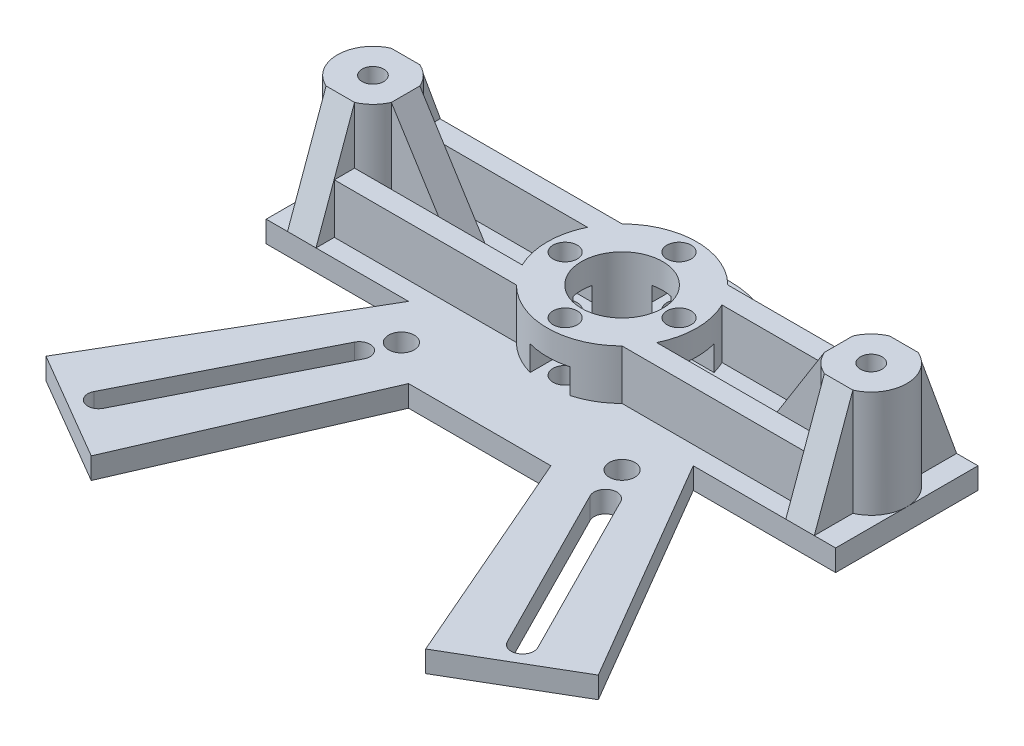
from build123d import *

# Parameters (mm, degrees)
SKETCH_1_R          = 3.2
SKETCH_1_R_2        = 1.8
SKETCH_1_R_3        = 5.7
SKETCH_1_R_4        = 1.7
EXTRUDE_1_DEPTH     = 3
SKETCH_2_R          = 10.5
EXTRUDE_2_DEPTH     = 7
SKETCH_4_R          = 1.7
CUT_EXTRUDE_1_DEPTH = 7
CUT_EXTRUDE_2_DEPTH = 3.5
SKETCH_6_R          = 5.7
CUT_EXTRUDE_3_DEPTH = 20
SKETCH_7_R          = 5
SKETCH_7_R_2        = 1.525
EXTRUDE_3_DEPTH     = 15
SKETCH_8_W          = 10
SKETCH_8_H          = 4
SKETCH_8_W_2        = 4
SKETCH_8_H_2        = 6
EXTRUDE_4_DEPTH     = 15
CUT_EXTRUDE_4_DEPTH = 15
CUT_EXTRUDE_5_DEPTH = 15
CUT_EXTRUDE_6_DEPTH = 15
SKETCH_12_W         = 25.575378798
SKETCH_12_H         = 2.842045507
EXTRUDE_5_DEPTH     = 7


with BuildPart() as part:
    # 草图1 → 凸台-拉伸1 (new body)
    with BuildSketch(Plane(origin=(0, 0, 0), x_dir=(1, 0, 0), z_dir=(0, 1, 0))):
        with BuildLine():
            Line((-35.081832586, -10), (-40, -10))
            Line((-40, -10), (-40, 10))
            Line((-40, 10), (-11.180339887, 10))
            ThreePointArc((-11.180339887, 10), (0, 15), (11.180339887, 10))
            Line((11.180339887, 10), (40, 10))
            Line((40, 10), (40, -10))
            Line((40, -10), (20, -10))
            Line((20, -10), (38.795982487, -42.134997854))
            Line((38.795982487, -42.134997854), (23.493176713, -51.085714784))
            Line((23.493176713, -51.085714784), (10.00055485, -20.000324527))
            Line((10.00055485, -20.000324527), (-9.99944515, -20.000324527))
            Line((-9.99944515, -20.000324527), (-23.493239928, -51.085714784))
            Line((-23.493239928, -51.085714784), (-38.79573581, -42.1354119))
            Line((-38.79573581, -42.1354119), (-20, -10))
            Line((-20, -10), (-35.081832586, -10))
        make_face()
        with Locations(Location((35, 0, 0), (0, 0, 270))):
            Circle(SKETCH_1_R, mode=Mode.SUBTRACT)
        with Locations(Location((-15.5, -15.5, 0), (0, 0, 270))):
            Circle(SKETCH_1_R_2, mode=Mode.SUBTRACT)
        with Locations(Location((15.5, -15.5, 0), (0, 0, 270))):
            Circle(SKETCH_1_R_2, mode=Mode.SUBTRACT)
        with Locations(Location((-35, 0, 0), (0, 0, 270))):
            Circle(SKETCH_1_R, mode=Mode.SUBTRACT)
        with Locations(Location((0, 0, 0), (0, 0, 270))):
            Circle(SKETCH_1_R_3, mode=Mode.SUBTRACT)
        with Locations(Location((-8, 0, 0), (0, 0, 270))):
            Circle(SKETCH_1_R_4, mode=Mode.SUBTRACT)
        with Locations(Location((0, 8, 0), (0, 0, 270))):
            Circle(SKETCH_1_R_4, mode=Mode.SUBTRACT)
        with Locations(Location((8, 0, 0), (0, 0, 270))):
            Circle(SKETCH_1_R_4, mode=Mode.SUBTRACT)
        with Locations(Location((0, -8, 0), (0, 0, 270))):
            Circle(SKETCH_1_R_4, mode=Mode.SUBTRACT)
        with BuildLine():
            Line((-16.131862345, -20.121977189), (-28.419219954, -44.445930008))
            ThreePointArc((-28.419219954, -44.445930008), (-30.461319047, -45.117305053), (-31.132694091, -43.07520596))
            Line((-31.132694091, -43.07520596), (-18.845336482, -18.75125314))
            ThreePointArc((-18.845336482, -18.75125314), (-16.803237389, -18.079878096), (-16.131862345, -20.121977189))
        make_face(mode=Mode.SUBTRACT)
        with BuildLine():
            Line((19.251434516, -19.436615165), (31.203359651, -43.037711333))
            ThreePointArc((31.203359651, -43.037711333), (30.498813674, -45.187970612), (28.348554395, -44.483424635))
            Line((28.348554395, -44.483424635), (16.39662926, -20.882328467))
            ThreePointArc((16.39662926, -20.882328467), (17.101175237, -18.732069188), (19.251434516, -19.436615165))
        make_face(mode=Mode.SUBTRACT)
    extrude(amount=EXTRUDE_1_DEPTH)

    # 草图2 → 凸台-拉伸2 (add)
    with BuildSketch(Plane(origin=(0, 3, 0), x_dir=(1, 0, 0), z_dir=(0, 1, 0))):
        with Locations(Location((0, 0, 0), (0, 0, 270))):
            Circle(SKETCH_2_R)
    extrude(amount=EXTRUDE_2_DEPTH)

    # 草图4 → 切除-拉伸1 (cut)
    with BuildSketch(Plane.XZ.offset(-3)):
        with Locations(Location((0, -8, 0), (0, 0, 270))):
            Circle(SKETCH_4_R)
        with Locations(Location((-8, 0, 0), (0, 0, 270))):
            Circle(SKETCH_4_R)
        with Locations(Location((8, 0, 0), (0, 0, 270))):
            Circle(SKETCH_4_R)
        with Locations(Location((0, 8, 0), (0, 0, 270))):
            Circle(SKETCH_4_R)
    extrude(amount=-CUT_EXTRUDE_1_DEPTH, mode=Mode.SUBTRACT)

    # 草图5 → 切除-拉伸2 (cut)
    with BuildSketch(Plane(origin=(0, 3, 0), x_dir=(1, 0, 0), z_dir=(0, 1, 0))):
        Polygon((-4.766838493, 0), (-6.383419246, 2.8), (-11.233161507, 2.8), (-11.233161507, -2.8), (-6.383419246, -2.8), align=None)
        Polygon((4.766838493, 0), (6.383419246, -2.8), (11.233161507, -2.8), (11.233161507, 2.8), (6.383419246, 2.8), align=None)
        Polygon((-2.8, 11.233161507), (-2.8, 6.383419246), (0, 4.766838493), (2.8, 6.383419246), (2.8, 11.233161507), align=None)
        Polygon((0, -4.766838493), (-2.8, -6.383419246), (-2.8, -11.233161507), (2.8, -11.233161507), (2.8, -6.383419246), align=None)
    extrude(amount=CUT_EXTRUDE_2_DEPTH, mode=Mode.SUBTRACT)

    # 草图6 → 切除-拉伸3 (cut)
    with BuildSketch(Plane.XZ.offset(-3)):
        with Locations(Location((0, 0, 0), (0, 0, 90))):
            Circle(SKETCH_6_R)
    extrude(amount=-CUT_EXTRUDE_3_DEPTH, mode=Mode.SUBTRACT)

    # 草图7 → 凸台-拉伸3 (add)
    # profile 1 of 2: a face of its own
    with BuildSketch(Plane(origin=(0, 3, 0), x_dir=(1, 0, 0), z_dir=(0, 1, 0))):
        with Locations(Location((-35, 0, 0), (0, 0, 180))):
            Circle(SKETCH_7_R)
        with Locations(Location((-35, 0, 0), (0, 0, 270))):
            Circle(SKETCH_7_R_2, mode=Mode.SUBTRACT)
    # profile 2 of 2: a face of its own
    with BuildSketch(Plane(origin=(0, 3, 0), x_dir=(1, 0, 0), z_dir=(0, 1, 0))):
        with Locations((35, 0)):
            Circle(SKETCH_7_R)
        with Locations(Location((35, 0, 0), (0, 0, 270))):
            Circle(SKETCH_7_R_2, mode=Mode.SUBTRACT)
    extrude(amount=EXTRUDE_3_DEPTH)

    # 草图8 → 凸台-拉伸4 (add)
    with BuildSketch(Plane(origin=(0, 3, 0), x_dir=(1, 0, 0), z_dir=(0, 1, 0))):
        with Locations((-26, 0)):
            Rectangle(SKETCH_8_W, SKETCH_8_H)
        with Locations((-35, 7)):
            Rectangle(SKETCH_8_W_2, SKETCH_8_H_2)
        with Locations((-35, -7)):
            Rectangle(SKETCH_8_W_2, SKETCH_8_H_2)
        with Locations((26, 0)):
            Rectangle(SKETCH_8_W, SKETCH_8_H)
        with Locations((35, 7)):
            Rectangle(SKETCH_8_W_2, SKETCH_8_H_2)
        with Locations((35, -7)):
            Rectangle(SKETCH_8_W_2, SKETCH_8_H_2)
    extrude(amount=EXTRUDE_4_DEPTH)

    # 草图9 → 切除-拉伸4 (cut)
    with BuildSketch(Plane.XY.offset(2)):
        Polygon((-30.417424305, 18), (-21, 3), (-21, 18), align=None)
        Polygon((21, 3), (30.417424305, 18), (21, 18), align=None)
    extrude(amount=-CUT_EXTRUDE_4_DEPTH, mode=Mode.SUBTRACT)

    # 草图10 → 切除-拉伸5 (cut)
    with BuildSketch(Plane.ZY.offset(-33)):
        Polygon((-4.582575695, 18), (-10, 3), (-10, 18), align=None)
        Polygon((4.582575695, 18), (10, 18), (10, 3), align=None)
    extrude(amount=-CUT_EXTRUDE_5_DEPTH, mode=Mode.SUBTRACT)

    # 草图11 → 切除-拉伸6 (cut)
    with BuildSketch(Plane(origin=(-33, 0, 0), x_dir=(0, 0, -1), z_dir=(1, 0, 0))):
        Polygon((-4.582575695, 18), (-10, 3), (-10, 18), align=None)
        Polygon((4.582575695, 18), (10, 3), (10, 18), align=None)
    extrude(amount=-CUT_EXTRUDE_6_DEPTH, mode=Mode.SUBTRACT)

    # 草图12 → 凸台-拉伸5 (add)
    with BuildSketch(Plane(origin=(0, 3, 0), x_dir=(1, 0, 0), z_dir=(0, 1, 0))):
        with Locations((-20.212310601, -6.003598449)):
            Rectangle(SKETCH_12_W, SKETCH_12_H)
        with Locations((-20.212310601, 6.003598449)):
            Rectangle(SKETCH_12_W, SKETCH_12_H)
        with Locations((20.212310601, 6.003598449)):
            Rectangle(SKETCH_12_W, SKETCH_12_H)
        with Locations((20.212310601, -6.003598449)):
            Rectangle(SKETCH_12_W, SKETCH_12_H)
    extrude(amount=EXTRUDE_5_DEPTH)


solid = part.part
